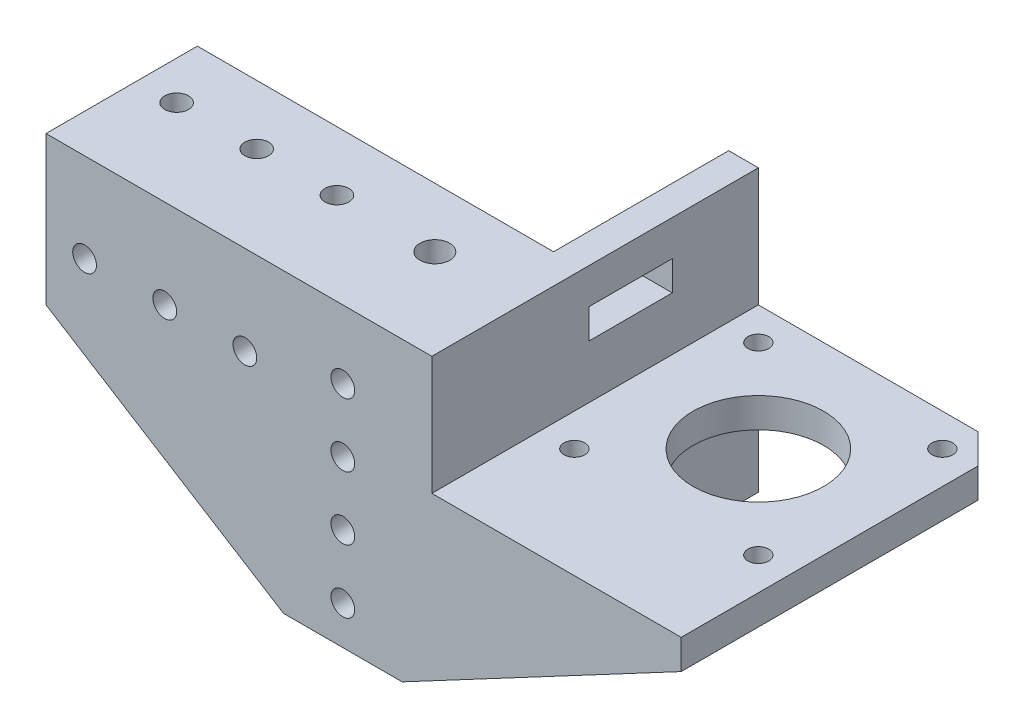
from build123d import *

# Parameters (mm, degrees)
BOSS_EXTRUDE1_DEPTH     = 5.5
SKETCH2_W               = 65
SKETCH2_H               = 25.5
BOSS_EXTRUDE2_DEPTH     = 5
SKETCH3_W               = 55
SKETCH3_H               = 25
BOSS_EXTRUDE3_DEPTH     = 5
SKETCH4_W               = 42
SKETCH4_H               = 55
BOSS_EXTRUDE4_DEPTH     = 5
BOSS_EXTRUDE6_DEPTH     = 7.5
BOSS_EXTRUDE7_DEPTH     = 42
SKETCH7_W               = 5
SKETCH7_H               = 29.5
BOSS_EXTRUDE8_DEPTH     = 5
SKETCH8_W               = 55
SKETCH8_H               = 20
CUT_EXTRUDE1_DEPTH      = 5
SKETCH9_R               = 2.5
SKETCH9_R_2             = 2
CUT_EXTRUDE2_DEPTH      = 98.155802709
SKETCH10_R              = 2
CUT_EXTRUDE3_DEPTH      = 91.21640649
CUT_EXTRUDE4_DEPTH      = 87.972696865
CUT_EXTRUDE4_DEPTH_BACK = 87.972696865
SKETCH11_R              = 1.75
SKETCH11_R_2            = 11
CHAMFER1_SIZE           = 5
SKETCH12_W              = 14
SKETCH12_H              = 5
CUT_EXTRUDE5_DEPTH      = 10


with BuildPart() as part:
    # Sketch1 → Boss-Extrude1 (new body)
    with BuildSketch(Plane.XY):
        Polygon((-40, 20), (-40, 0), (0, -25), (20, -25), (67, 0), (25, 0), (25, 20), align=None)
    extrude(amount=BOSS_EXTRUDE1_DEPTH)

    # Sketch2 → Boss-Extrude2 (add)
    with BuildSketch(Plane(origin=(0, 20, 0), x_dir=(1, 0, 0), z_dir=(0, 1, 0))):
        with Locations((-7.5, 7.25)):
            Rectangle(SKETCH2_W, SKETCH2_H)
    extrude(amount=BOSS_EXTRUDE2_DEPTH)

    # Sketch3 → Boss-Extrude3 (add)
    with BuildSketch(Plane(origin=(25, 0, 0), x_dir=(0, 0, -1), z_dir=(1, 0, 0))):
        with Locations((22, 12.5)):
            Rectangle(SKETCH3_W, SKETCH3_H)
    extrude(amount=BOSS_EXTRUDE3_DEPTH)

    # Sketch4 → Boss-Extrude4 (add)
    with BuildSketch(Plane(origin=(0, 0, 0), x_dir=(1, 0, 0), z_dir=(0, 1, 0))):
        with Locations((46, 22)):
            Rectangle(SKETCH4_W, SKETCH4_H)
    extrude(amount=BOSS_EXTRUDE4_DEPTH)

    # Sketch5 → Boss-Extrude6 (add)
    with BuildSketch(Plane(origin=(0, 0, 0), x_dir=(-1, 0, 0), z_dir=(0, 0, -1))):
        Polygon((-20, -25), (-20, 20), (-25, 20), (-25, 0), (-67, 0), align=None)
    extrude(amount=BOSS_EXTRUDE6_DEPTH)

    # Sketch6 → Boss-Extrude7 (add)
    with BuildSketch(Plane(origin=(0, 0, -7.5), x_dir=(-1, 0, 0), z_dir=(0, 0, -1))):
        Polygon((-25, 0), (-25, -22.340425532), (-20, -25), (-20, 20), (-25, 20), align=None)
    extrude(amount=BOSS_EXTRUDE7_DEPTH)

    # Sketch7 → Boss-Extrude8 (add)
    with BuildSketch(Plane(origin=(0, 20, 0), x_dir=(1, 0, 0), z_dir=(0, 1, 0))):
        with Locations((22.5, 34.75)):
            Rectangle(SKETCH7_W, SKETCH7_H)
    extrude(amount=BOSS_EXTRUDE8_DEPTH)

    # Sketch8 → Cut-Extrude1 (cut)
    with BuildSketch(Plane(origin=(30, 0, 0), x_dir=(0, 0, -1), z_dir=(1, 0, 0))):
        with Locations((22, 15)):
            Rectangle(SKETCH8_W, SKETCH8_H)
    extrude(amount=-CUT_EXTRUDE1_DEPTH, mode=Mode.SUBTRACT)

    # Sketch9 → Cut-Extrude2 (cut, through all)
    with BuildSketch(Plane(origin=(0, 25, 0), x_dir=(1, 0, 0), z_dir=(0, 1, 0))):
        with Locations(Location((10, 10, 0), (0, 0, 270))):
            Circle(SKETCH9_R)
        with Locations(Location((-33.5, 10, 0), (0, 0, 270))):
            Circle(SKETCH9_R_2)
        with Locations(Location((-20, 10, 0), (0, 0, 270))):
            Circle(SKETCH9_R_2)
        with Locations(Location((-6.5, 10, 0), (0, 0, 270))):
            Circle(SKETCH9_R_2)
    extrude(amount=-CUT_EXTRUDE2_DEPTH, mode=Mode.SUBTRACT)

    # Sketch10 → Cut-Extrude3 (cut, through all)
    with BuildSketch(Plane.XY.offset(5.5)):
        with Locations((-33.5, 10)):
            Circle(SKETCH10_R)
        with Locations((-20, 10)):
            Circle(SKETCH10_R)
        with Locations((-6.5, 10)):
            Circle(SKETCH10_R)
        with Locations((10, -18.5)):
            Circle(SKETCH10_R)
        with Locations((10, -7.833333333)):
            Circle(SKETCH10_R)
        with Locations((10, 2.833333333)):
            Circle(SKETCH10_R)
        with Locations((10, 13.5)):
            Circle(SKETCH10_R)
    extrude(amount=-CUT_EXTRUDE3_DEPTH, mode=Mode.SUBTRACT)

    # Sketch11 → Cut-Extrude4 (cut, two sides: drawn at the far end of the back side and taken through both)
    with BuildSketch(Plane.XZ.offset(-CUT_EXTRUDE4_DEPTH_BACK)):
        with Locations(Location((61.5, -44, 0), (0, 0, 90))):
            Circle(SKETCH11_R)
        with Locations(Location((61.5, -13, 0), (0, 0, 90))):
            Circle(SKETCH11_R)
        with Locations(Location((30.5, -13, 0), (0, 0, 90))):
            Circle(SKETCH11_R)
        with Locations(Location((30.5, -44, 0), (0, 0, 90))):
            Circle(SKETCH11_R)
        with Locations(Location((46, -28.5, 0), (0, 0, 90))):
            Circle(SKETCH11_R_2)
    extrude(amount=CUT_EXTRUDE4_DEPTH + CUT_EXTRUDE4_DEPTH_BACK, mode=Mode.SUBTRACT)

    # Chamfer1
    chamfer1_edges = [part.edges().sort_by_distance(p)[0] for p in [
        (67, 2.5, -49.5),
    ]]
    chamfer(chamfer1_edges, length=CHAMFER1_SIZE)

    # Sketch12 → Cut-Extrude5 (cut)
    with BuildSketch(Plane(origin=(25, 0, 0), x_dir=(0, 0, -1), z_dir=(1, 0, 0))):
        with Locations((28, 16.5)):
            Rectangle(SKETCH12_W, SKETCH12_H)
    extrude(amount=-CUT_EXTRUDE5_DEPTH, mode=Mode.SUBTRACT)


solid = part.part
